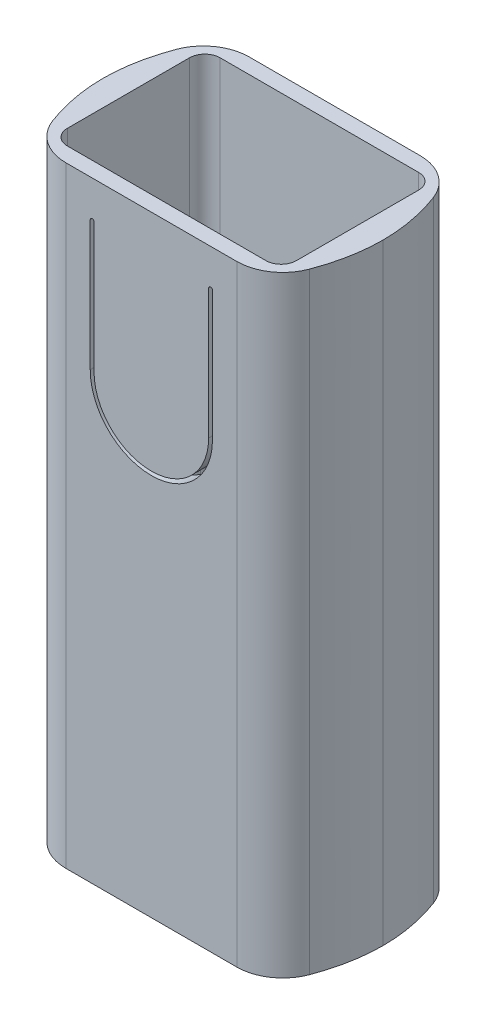
from build123d import *

# Parameters (mm, degrees)
BOSS_EXTRUDE4_DEPTH = 80
BOSS_EXTRUDE5_DEPTH = 57
CUT_EXTRUDE1_DEPTH  = 2


with BuildPart() as part:
    # Sketch8 → Boss-Extrude4 (new body)
    with BuildSketch(Plane(origin=(0, 58, 0), x_dir=(1, 0, 0), z_dir=(0, 1, 0))):
        with BuildLine():
            Line((-11.194828593, 12.000000011), (11.194828559, 12.000000011))
            ThreePointArc((11.194828559, 12.000000011), (14.611088941, 10.932460351), (16.811684841, 8.109721678))
            add(Edge.make_bspline(
                [(18.334712564, 1.1e-08), (18.327162677, 2.726130673), (17.819510816, 5.426517656), (16.811684841, 8.109721678)],
                knots=[0.502499344, 0.502499344, 0.502499344, 0.502499344, 0.837905074, 0.837905074, 0.837905074, 0.837905074], degree=3))
            add(Edge.make_bspline(
                [(18.334712564, 1.1e-08), (18.327162677, -2.72613065), (17.819510816, -5.426517634), (16.811684841, -8.109721656)],
                knots=[0.502499344, 0.502499344, 0.502499344, 0.502499344, 0.837905074, 0.837905074, 0.837905074, 0.837905074], degree=3))
            ThreePointArc((16.811684841, -8.109721656), (14.611088941, -10.932460328), (11.194828559, -11.999999989))
            Line((11.194828559, -11.999999989), (-11.194828593, -11.999999989))
            ThreePointArc((-11.194828593, -11.999999989), (-14.611088975, -10.932460328), (-16.811684874, -8.109721656))
            add(Edge.make_bspline(
                [(-18.334712598, 1.1e-08), (-18.327162711, -2.72613065), (-17.81951085, -5.426517634), (-16.811684874, -8.109721656)],
                knots=[0.502499344, 0.502499344, 0.502499344, 0.502499344, 0.837905074, 0.837905074, 0.837905074, 0.837905074], degree=3))
            add(Edge.make_bspline(
                [(-18.334712598, 1.1e-08), (-18.327162711, 2.726130673), (-17.81951085, 5.426517656), (-16.811684874, 8.109721678)],
                knots=[0.502499344, 0.502499344, 0.502499344, 0.502499344, 0.837905074, 0.837905074, 0.837905074, 0.837905074], degree=3))
            ThreePointArc((-16.811684874, 8.109721678), (-14.611088975, 10.932460351), (-11.194828593, 12.000000011))
        make_face()
        with BuildLine():
            Line((-15.000000017, -7.999999989), (-15.000000017, 8.000000011))
            ThreePointArc((-15.000000017, 8.000000011), (-14.414213579, 9.414213574), (-13.000000017, 10.000000011))
            Line((-13.000000017, 10.000000011), (12.999999983, 10.000000011))
            ThreePointArc((12.999999983, 10.000000011), (14.414213546, 9.414213574), (14.999999983, 8.000000011))
            Line((14.999999983, 8.000000011), (14.999999983, -7.999999989))
            ThreePointArc((14.999999983, -7.999999989), (14.414213546, -9.414213551), (12.999999983, -9.999999989))
            Line((12.999999983, -9.999999989), (-13.000000017, -9.999999989))
            ThreePointArc((-13.000000017, -9.999999989), (-14.414213579, -9.414213551), (-15.000000017, -7.999999989))
        make_face(mode=Mode.SUBTRACT)
    extrude(amount=BOSS_EXTRUDE4_DEPTH)

    # Sketch11 → Boss-Extrude5 (add)
    with BuildSketch(Plane(origin=(0, 58, 0), x_dir=(1, 0, 0), z_dir=(0, 1, 0))):
        with BuildLine():
            Line((13, 10.000000011), (15, 10.000000011))
            Line((15, 10.000000011), (15, 6.937911183))
            Line((15, 6.937911183), (13.5, 6.937911183))
            ThreePointArc((13.5, 6.937911183), (13.146446609, 7.084357793), (13, 7.437911183))
            Line((13, 7.437911183), (13, 10.000000011))
        make_face()
        with BuildLine():
            Line((-13, 7.437911183), (-13, 10.000000011))
            Line((-13, 10.000000011), (-15, 10.000000011))
            Line((-15, 10.000000011), (-15, 6.937911183))
            Line((-15, 6.937911183), (-13.5, 6.937911183))
            ThreePointArc((-13.5, 6.937911183), (-13.146446609, 7.084357793), (-13, 7.437911183))
        make_face()
    extrude(amount=BOSS_EXTRUDE5_DEPTH)

    # Sketch12 → Cut-Extrude1 (cut)
    with BuildSketch(Plane.XY.offset(11.999999989)):
        with BuildLine():
            Line((7.5, 133.134156445), (7.5, 116.134156445))
            ThreePointArc((7.5, 116.134156445), (0, 108.634156445), (-7.5, 116.134156445))
            Line((-7.5, 116.134156445), (-7.5, 133.134156445))
            ThreePointArc((-7.5, 133.134156445), (-7.75, 133.384156445), (-8, 133.134156445))
            Line((-8, 133.134156445), (-8, 116.134156445))
            ThreePointArc((-8, 116.134156445), (0, 108.134156445), (8, 116.134156445))
            Line((8, 116.134156445), (8, 133.134156445))
            ThreePointArc((8, 133.134156445), (7.75, 133.384156445), (7.5, 133.134156445))
        make_face()
    extrude(amount=-CUT_EXTRUDE1_DEPTH, mode=Mode.SUBTRACT)


solid = part.part
